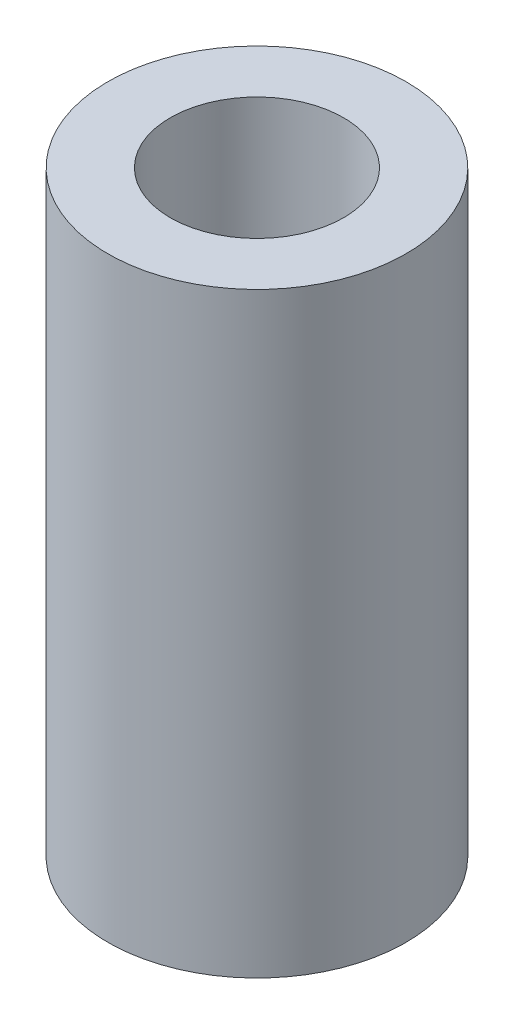
from build123d import *

# Parameters (mm, degrees)
SKETCH1_R           = 4.7625
BOSS_EXTRUDE1_DEPTH = 19.05
SKETCH2_R           = 2.7686
CUT_EXTRUDE1_DEPTH  = 19.05


with BuildPart() as part:
    # Sketch1 → Boss-Extrude1 (new body)
    with BuildSketch(Plane(origin=(0, 0, 0), x_dir=(1, 0, 0), z_dir=(0, 1, 0))):
        with Locations(Location((-37.503476793, 4.708228688, 0), (0, 0, 90))):
            Circle(SKETCH1_R)
    extrude(amount=BOSS_EXTRUDE1_DEPTH)

    # Sketch2 → Cut-Extrude1 (cut)
    with BuildSketch(Plane(origin=(0, 19.05, 0), x_dir=(1, 0, 0), z_dir=(0, 1, 0))):
        with Locations(Location((-37.503476793, 4.708228688, 0), (0, 0, 270))):
            Circle(SKETCH2_R)
    extrude(amount=-CUT_EXTRUDE1_DEPTH, mode=Mode.SUBTRACT)


solid = part.part
